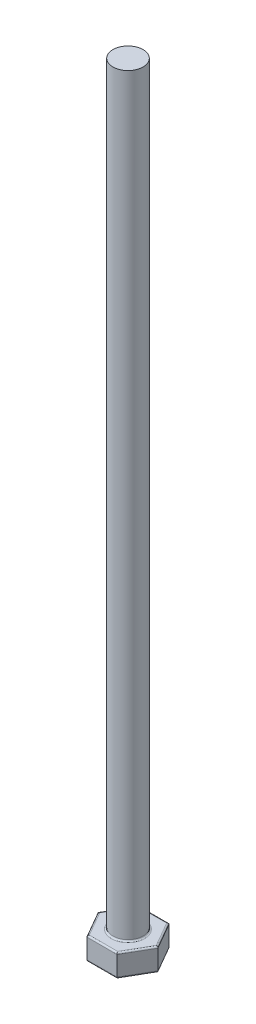
from build123d import *

# Parameters (mm, degrees)
SKETCH1_R           = 2
BOSS_EXTRUDE1_DEPTH = 100
BOSS_EXTRUDE2_DEPTH = 3
FILLET2_R           = 0.2


with BuildPart() as part:
    # Sketch1 → Boss-Extrude1 (new body)
    with BuildSketch(Plane(origin=(0, 0, 0), x_dir=(1, 0, 0), z_dir=(0, 1, 0))):
        with Locations(Location((0, 0, 0), (0, 0, 270))):
            Circle(SKETCH1_R)
    extrude(amount=BOSS_EXTRUDE1_DEPTH)

    # Sketch2 → Boss-Extrude2 (add)
    with BuildSketch(Plane.XZ):
        Polygon((3.983716857, 0), (1.991858429, 3.45), (-1.991858429, 3.45), (-3.983716857, 0), (-1.991858429, -3.45), (1.991858429, -3.45), align=None)
    extrude(amount=BOSS_EXTRUDE2_DEPTH)

    # Fillet2
    fillet2_edges = [part.edges().sort_by_distance(p)[0] for p in [
        (0, 0, -2),
        (2.987787643, 0, -1.725),
        (2.987787643, 0, 1.725),
        (0, 0, 3.45),
        (-2.987787643, 0, 1.725),
        (-2.987787643, 0, -1.725),
        (0, 0, -3.45),
        (2.987787643, -3, -1.725),
        (2.987787643, -3, 1.725),
        (0, -3, 3.45),
        (-2.987787643, -3, 1.725),
        (-2.987787643, -3, -1.725),
        (0, -3, -3.45),
    ]]
    fillet(fillet2_edges, radius=FILLET2_R)


solid = part.part
